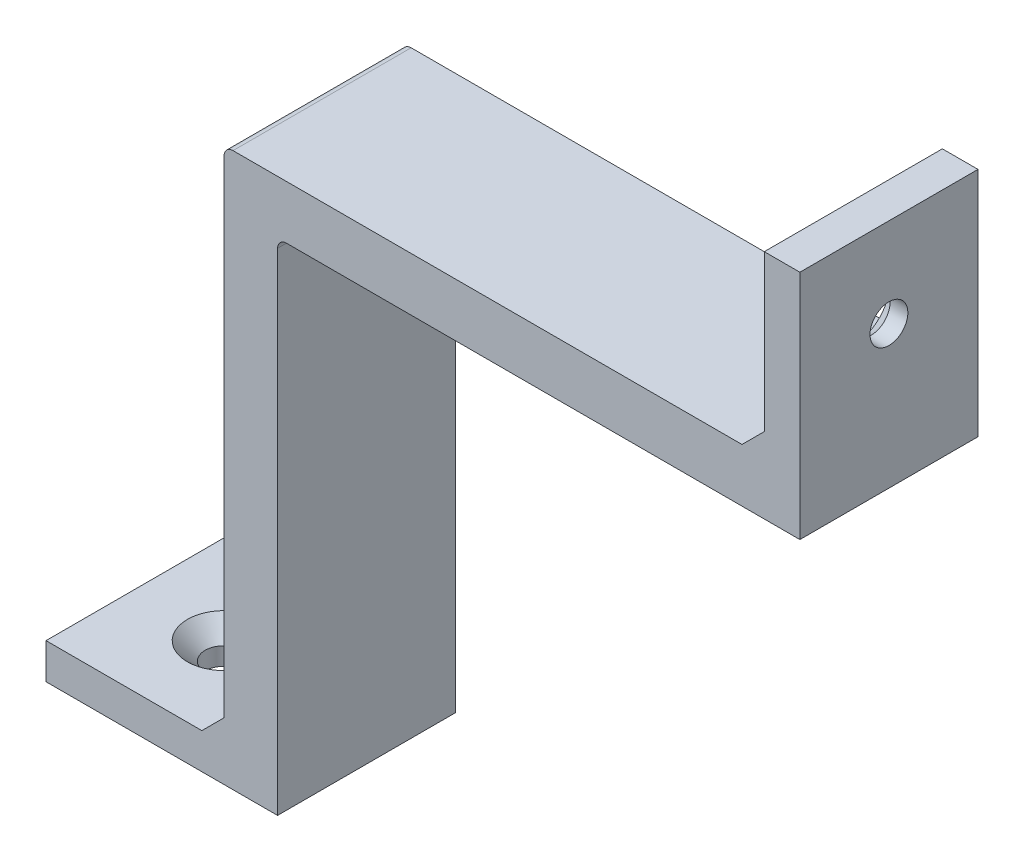
from build123d import *

# Parameters (mm, degrees)
SKETCH1_W           = 20
SKETCH1_H           = 4
SKETCH1_W_2         = 4
SKETCH1_H_2         = 20
BOSS_EXTRUDE1_DEPTH = 20
SKETCH2_R           = 2.125
CUT_EXTRUDE1_DEPTH  = 100.735876193
SKETCH3_R           = 2.125
CUT_EXTRUDE2_DEPTH  = 108.560738655
CHAMFER1_SIZE       = 2
CHAMFER2_SIZE       = 2.5
FILLET1_R           = 1


with BuildPart() as part:
    # Sketch1 → Boss-Extrude1 (new body)
    with BuildSketch(Plane.XY):
        with Locations((-16, -11.85)):
            Rectangle(SKETCH1_W, SKETCH1_H)
        Polygon((58.65, 48.3), (58.65, 42.3), (0, 42.3), (0, -13.85), (-6, -13.85), (-6, 48.3), align=None)
        with Locations((56.65, 58.3)):
            Rectangle(SKETCH1_W_2, SKETCH1_H_2)
    extrude(amount=BOSS_EXTRUDE1_DEPTH)

    # Sketch2 → Cut-Extrude1 (cut, through all)
    with BuildSketch(Plane(origin=(0, -9.85, 0), x_dir=(1, 0, 0), z_dir=(0, 1, 0))):
        with Locations(Location((-16, -10, 0), (0, 0, 180))):
            Circle(SKETCH2_R)
    extrude(amount=-CUT_EXTRUDE1_DEPTH, mode=Mode.SUBTRACT)

    # Sketch3 → Cut-Extrude2 (cut, through all)
    with BuildSketch(Plane.ZY.offset(-54.65)):
        with Locations(Location((10, 58.3, 0), (0, 0, 270))):
            Circle(SKETCH3_R)
    extrude(amount=-CUT_EXTRUDE2_DEPTH, mode=Mode.SUBTRACT)

    # Chamfer1
    chamfer1_edges = [part.edges().sort_by_distance(p)[0] for p in [
        (-13.875, -9.85, 10),
        (54.65, 60.425, 10),
    ]]
    chamfer(chamfer1_edges, length=CHAMFER1_SIZE)

    # Chamfer2
    chamfer2_edges = [part.edges().sort_by_distance(p)[0] for p in [
        (-6, -9.85, 10),
        (54.65, 48.3, 10),
    ]]
    chamfer(chamfer2_edges, length=CHAMFER2_SIZE)

    # Fillet1
    fillet1_edges = [part.edges().sort_by_distance(p)[0] for p in [
        (-6, 48.3, 10),
        (0, 42.3, 10),
    ]]
    fillet(fillet1_edges, radius=FILLET1_R)


solid = part.part
